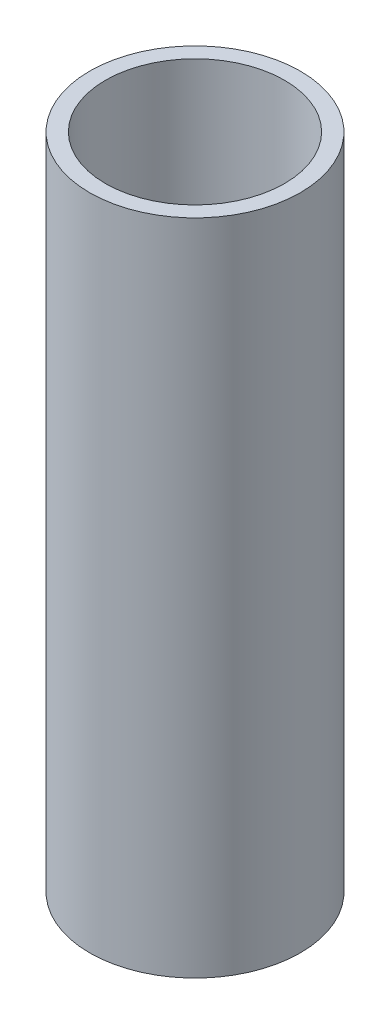
from build123d import *

# Parameters (mm, degrees)
SKETCH1_R           = 8
SKETCH1_R_2         = 6.8
BOSS_EXTRUDE1_DEPTH = 50
SKETCH2_R           = 0.5
CUT_EXTRUDE1_DEPTH  = 52.264022472


with BuildPart() as part:
    # Sketch1 → Boss-Extrude1 (new body)
    with BuildSketch(Plane(origin=(0, 0, 0), x_dir=(1, 0, 0), z_dir=(0, 1, 0))):
        with Locations(Location((0, 0, 0), (0, 0, 270))):
            Circle(SKETCH1_R)
        with Locations(Location((0, 0, 0), (0, 0, 270))):
            Circle(SKETCH1_R_2, mode=Mode.SUBTRACT)
    extrude(amount=BOSS_EXTRUDE1_DEPTH)

    # Sketch2 → Cut-Extrude1 (cut, through all)
    with BuildSketch(Plane(origin=(0, 0, 0), x_dir=(0, 0, -1), z_dir=(1, 0, 0))):
        with Locations((0, 25)):
            Circle(SKETCH2_R)
    extrude(amount=-CUT_EXTRUDE1_DEPTH, mode=Mode.SUBTRACT)


solid = part.part
